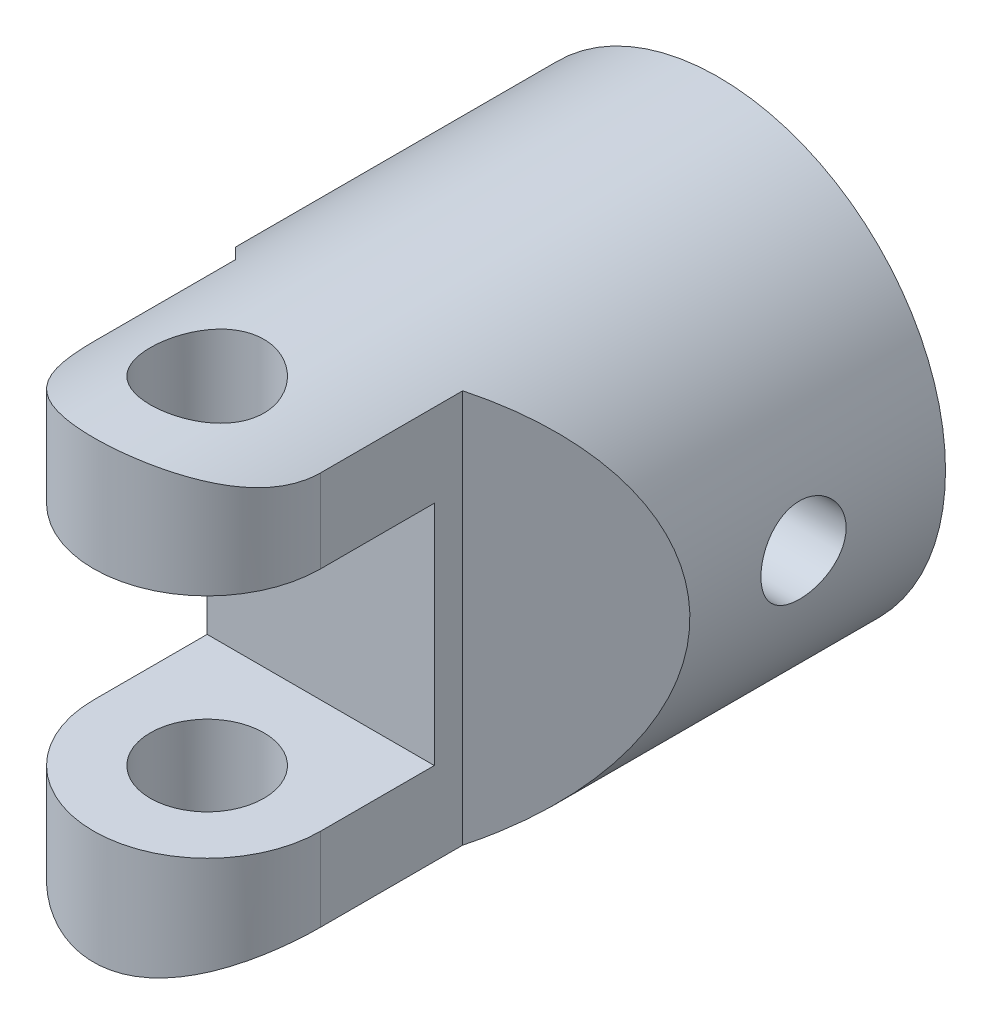
from build123d import *

# Parameters (mm, degrees)
SKETCH_1_R               = 8
EXTRUDE_1_DEPTH          = 22
CUT_EXTRUDE_1_DEPTH      = 25.738633754
CUT_EXTRUDE_1_DEPTH_BACK = 25.738633754
CUT_EXTRUDE_2_DEPTH      = 26
CUT_EXTRUDE_2_DEPTH_BACK = 26
SKETCH_3_R               = 2
CUT_EXTRUDE_3_DEPTH      = 26
CUT_EXTRUDE_3_DEPTH_BACK = 26
SKETCH_4_W               = 8
SKETCH_4_H               = 8
SKETCH_5_R               = 4
CUT_EXTRUDE_4_DEPTH      = 9
CUT_EXTRUDE_5_DEPTH      = 25.738633908
CUT_EXTRUDE_5_DEPTH_BACK = 25.738633908
SKETCH_6_R               = 1.5


with BuildPart() as part:
    # 草图1 → 拉伸1 (new body)
    with BuildSketch(Plane.XY):
        Circle(SKETCH_1_R)
    extrude(amount=EXTRUDE_1_DEPTH)

    # 草图2 → 切除-拉伸1 (cut, two sides: drawn at the far end of the back side and taken through both)
    with BuildSketch(Plane(origin=(0, 0, 0), x_dir=(1, 0, 0), z_dir=(0, 1, 0)).offset(-CUT_EXTRUDE_1_DEPTH_BACK)):
        with BuildLine():
            Line((8, -9), (4, -13))
            Line((4, -13), (4, -18))
            ThreePointArc((4, -18), (0, -22), (-4, -18))
            Line((-4, -18), (-4, -13))
            Line((-4, -13), (-8, -9))
            Line((-8, -9), (-8, -22))
            Line((-8, -22), (1.483160763, -24.700219192))
            Line((1.483160763, -24.700219192), (8, -22))
            Line((8, -22), (8, -9))
        make_face()
    extrude(amount=CUT_EXTRUDE_1_DEPTH + CUT_EXTRUDE_1_DEPTH_BACK, mode=Mode.SUBTRACT)

    # 草图3 → 切除-拉伸2 (cut, two sides: drawn at the far end of the back side and taken through both)
    with BuildSketch(Plane(origin=(0, 0, 0), x_dir=(1, 0, 0), z_dir=(0, 1, 0)).offset(-CUT_EXTRUDE_2_DEPTH_BACK)):
        with Locations((0, -18)):
            Circle(SKETCH_3_R)
    extrude(amount=CUT_EXTRUDE_2_DEPTH + CUT_EXTRUDE_2_DEPTH_BACK, mode=Mode.SUBTRACT)

    # 草图4 → 切除-拉伸3 (cut, two sides: drawn at the far end of the back side and taken through both)
    with BuildSketch(Plane(origin=(0, 0, 0), x_dir=(0, 0, -1), z_dir=(1, 0, 0)).offset(-CUT_EXTRUDE_3_DEPTH_BACK)):
        with Locations((-18, 0)):
            Rectangle(SKETCH_4_W, SKETCH_4_H)
    extrude(amount=CUT_EXTRUDE_3_DEPTH + CUT_EXTRUDE_3_DEPTH_BACK, mode=Mode.SUBTRACT)

    # 草图5 → 切除-拉伸4 (cut)
    with BuildSketch(Plane(origin=(0, 0, 0), x_dir=(-1, 0, 0), z_dir=(0, 0, -1))):
        Circle(SKETCH_5_R)
    extrude(amount=-CUT_EXTRUDE_4_DEPTH, mode=Mode.SUBTRACT)

    # 草图6 → 切除-拉伸5 (cut, two sides: drawn at the far end of the back side and taken through both)
    with BuildSketch(Plane(origin=(0, 0, 0), x_dir=(0, 0, -1), z_dir=(1, 0, 0)).offset(-CUT_EXTRUDE_5_DEPTH_BACK)):
        with Locations((-5, 0)):
            Circle(SKETCH_6_R)
    extrude(amount=CUT_EXTRUDE_5_DEPTH + CUT_EXTRUDE_5_DEPTH_BACK, mode=Mode.SUBTRACT)


solid = part.part
